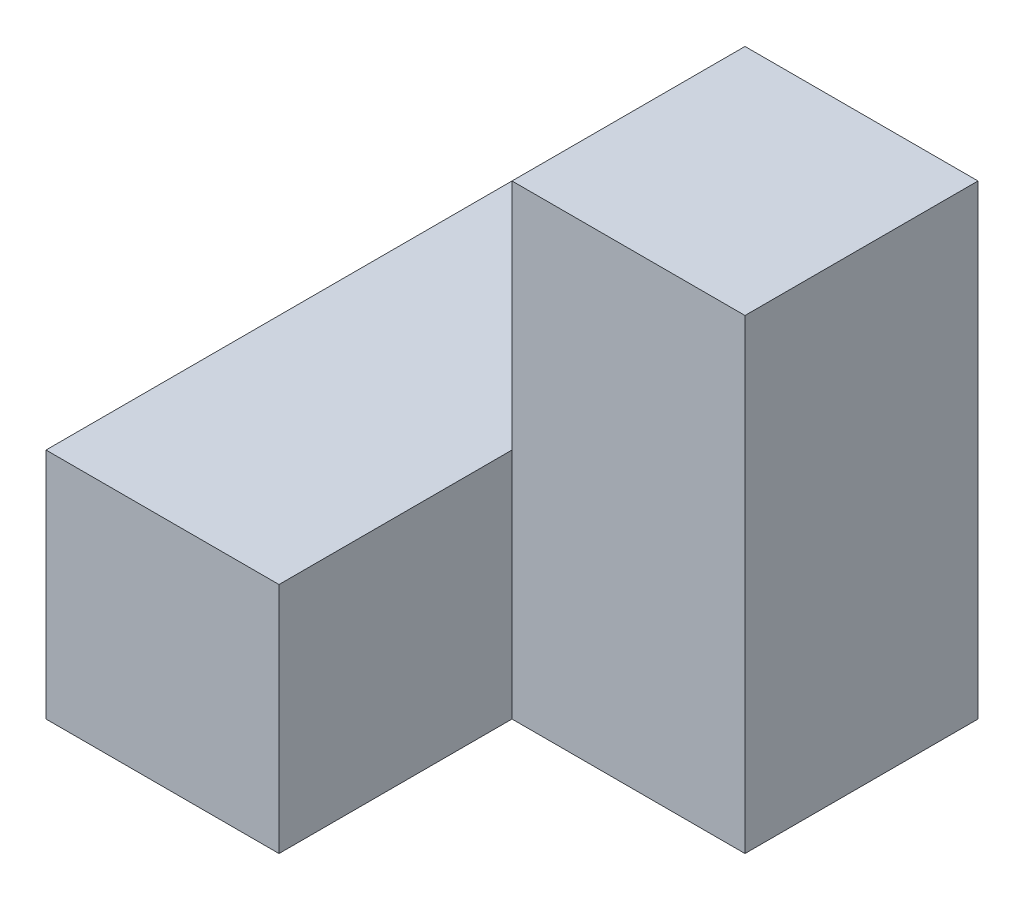
from build123d import *

# Parameters (mm, degrees)
BOSS_EXTRUDE1_DEPTH = 30
SKETCH2_W           = 30
SKETCH2_H           = 30
BOSS_EXTRUDE2_DEPTH = 30


with BuildPart() as part:
    # Sketch1 → Boss-Extrude1 (new body)
    with BuildSketch(Plane(origin=(0, 0, 0), x_dir=(1, 0, 0), z_dir=(0, 1, 0))):
        Polygon((0, 0), (30, 0), (30, 30), (-30, 30), (-30, -30), (0, -30), align=None)
    extrude(amount=BOSS_EXTRUDE1_DEPTH)

    # Sketch2 → Boss-Extrude2 (add)
    with BuildSketch(Plane(origin=(0, 30, 0), x_dir=(1, 0, 0), z_dir=(0, 1, 0))):
        with Locations((15, 15)):
            Rectangle(SKETCH2_W, SKETCH2_H)
    extrude(amount=BOSS_EXTRUDE2_DEPTH)


solid = part.part
